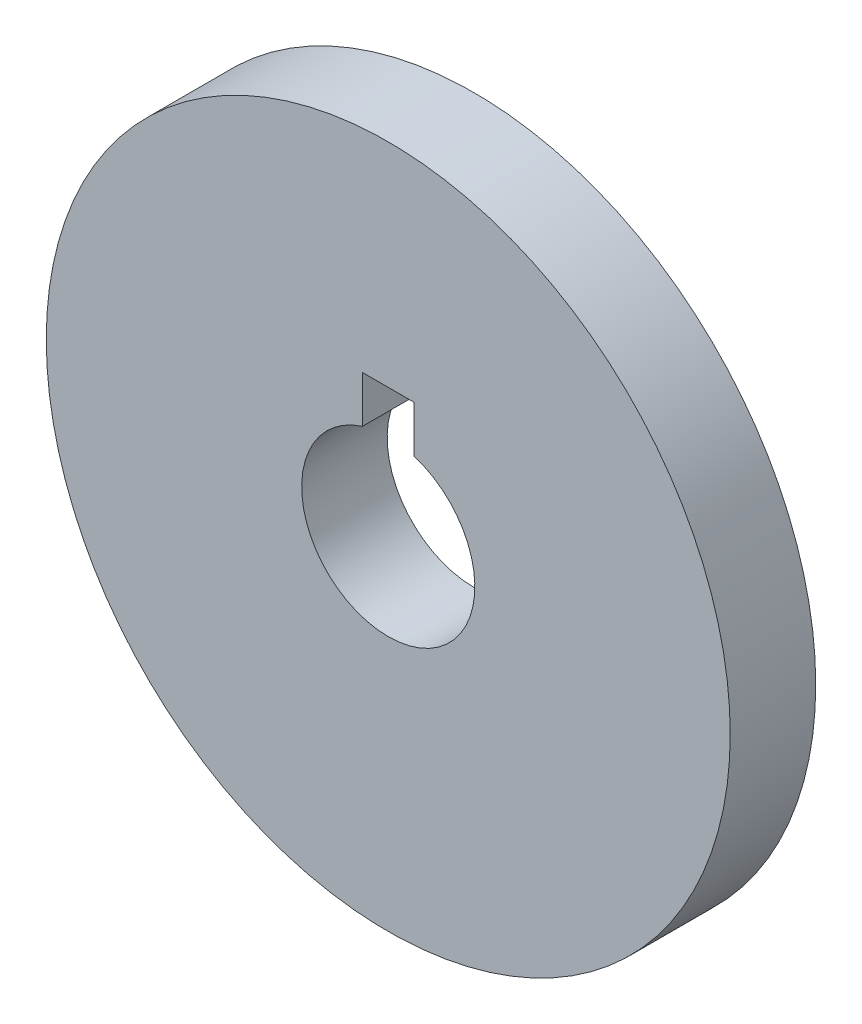
from build123d import *

# Parameters (mm, degrees)
SKETCH1_R           = 40
SKETCH1_R_2         = 10.125
BOSS_EXTRUDE1_DEPTH = 10
SKETCH2_W           = 6.05
SKETCH2_H           = 10
CUT_EXTRUDE1_DEPTH  = 10


with BuildPart() as part:
    # Sketch1 → Boss-Extrude1 (new body)
    with BuildSketch(Plane.XY):
        Circle(SKETCH1_R)
        Circle(SKETCH1_R_2, mode=Mode.SUBTRACT)
    extrude(amount=BOSS_EXTRUDE1_DEPTH)

    # Sketch2 → Cut-Extrude1 (cut)
    with BuildSketch(Plane.XY.offset(10)):
        with Locations((0, 10.125)):
            Rectangle(SKETCH2_W, SKETCH2_H)
    extrude(amount=-CUT_EXTRUDE1_DEPTH, mode=Mode.SUBTRACT)


solid = part.part
